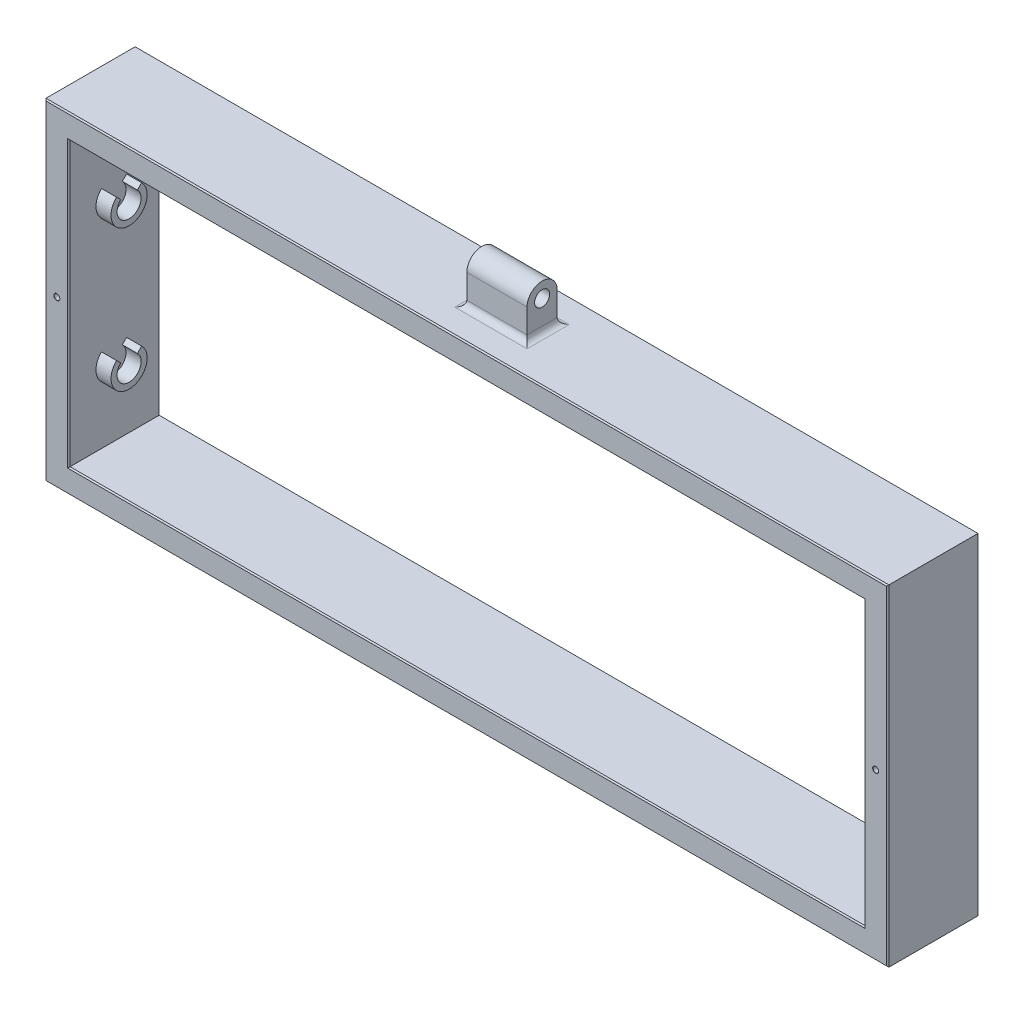
from build123d import *

# Parameters (mm, degrees)
SKETCH1_W                                = 140
SKETCH1_H                                = 55
SKETCH1_W_2                              = 132
SKETCH1_H_2                              = 47
RECTANGLE_PAD_DEPTH                      = 15
MOUNTINGHOLES_DEPTH                      = 2.5
TAP_DRILL_FOR_M1_2X0_25_TAP2_D           = 0.95
TAP_DRILL_FOR_M1_2X0_25_TAP2_CSINK_D     = 1
TAP_DRILL_FOR_M1_2X0_25_TAP2_CSINK_ANGLE = 90
CHAMFER3_SIZE                            = 0.2
BOSS_EXTRUDE1_DEPTH                      = 10
FILLET1_R                                = 1
SKETCH7_R                                = 1.25
CUT_EXTRUDE1_DEPTH                       = 10


with BuildPart() as part:
    # Sketch1 → Rectangle Pad (new body)
    with BuildSketch(Plane.XY):
        Rectangle(SKETCH1_W, SKETCH1_H)
        Rectangle(SKETCH1_W_2, SKETCH1_H_2, mode=Mode.SUBTRACT)
    extrude(amount=RECTANGLE_PAD_DEPTH)

    # Sketch2 → MountingHoles (add)
    with BuildSketch(Plane.ZY.offset(-66)):
        with BuildLine():
            Line((8.875, 13.202368755), (9.582283213, 13.909651968))
            ThreePointArc((9.582283213, 13.909651968), (7.5, 8.75), (5.417716787, 13.909651968))
            Line((5.417716787, 13.909651968), (6.125, 13.202368755))
            ThreePointArc((6.125, 13.202368755), (7.5, 9.75), (8.875, 13.202368755))
        make_face()
        with BuildLine():
            Line((8.875, -10.297631245), (9.582283213, -9.590348032))
            ThreePointArc((9.582283213, -9.590348032), (7.5, -14.75), (5.417716787, -9.590348032))
            Line((5.417716787, -9.590348032), (6.125, -10.297631245))
            ThreePointArc((6.125, -10.297631245), (7.5, -13.75), (8.875, -10.297631245))
        make_face()
    mountingholes = extrude(amount=MOUNTINGHOLES_DEPTH)

    # Mirror1: MountingHoles across plane
    add(mountingholes.mirror(Plane(origin=(0, 0, 0), x_dir=(0, 0, 1), z_dir=(1, 0, 0))))

    # Tap Drill for M1.2x0.25 Tap2 (through all)
    with Locations(Plane.XY.offset(15)):
        with Locations((68, 0), (-68, 0)):
            CounterSinkHole(TAP_DRILL_FOR_M1_2X0_25_TAP2_D / 2, TAP_DRILL_FOR_M1_2X0_25_TAP2_CSINK_D / 2, counter_sink_angle=TAP_DRILL_FOR_M1_2X0_25_TAP2_CSINK_ANGLE)

    # Chamfer3
    chamfer3_edges = [part.edges().sort_by_distance(p)[0] for p in [
        (-70, 0, 15),
        (66, 0, 15),
        (0, -27.5, 15),
        (0, 23.5, 15),
        (-66, 0, 15),
        (0, -23.5, 15),
        (70, 0, 15),
        (0, 27.5, 15),
    ]]
    chamfer(chamfer3_edges, length=CHAMFER3_SIZE)

    # Sketch6 → Boss-Extrude1 (add)
    with BuildSketch(Plane(origin=(-5, 0, 0), x_dir=(0, 0, -1), z_dir=(1, 0, 0))):
        with BuildLine():
            Line((-9.9, 32.5), (-9.9, 27.5))
            Line((-9.9, 27.5), (-4.9, 27.5))
            Line((-4.9, 27.5), (-4.9, 32.5))
            ThreePointArc((-4.9, 32.5), (-7.4, 35), (-9.9, 32.5))
        make_face()
    extrude(amount=BOSS_EXTRUDE1_DEPTH)

    # Fillet1
    fillet1_edges = [part.edges().sort_by_distance(p)[0] for p in [
        (-5, 27.5, 7.4),
        (0, 27.5, 9.9),
        (0, 27.5, 4.9),
        (5, 27.5, 7.4),
    ]]
    fillet(fillet1_edges, radius=FILLET1_R)

    # Sketch7 → Cut-Extrude1 (cut)
    with BuildSketch(Plane.ZY.offset(5)):
        with Locations((7.4, 32.5)):
            Circle(SKETCH7_R)
    extrude(amount=-CUT_EXTRUDE1_DEPTH, mode=Mode.SUBTRACT)


solid = part.part
